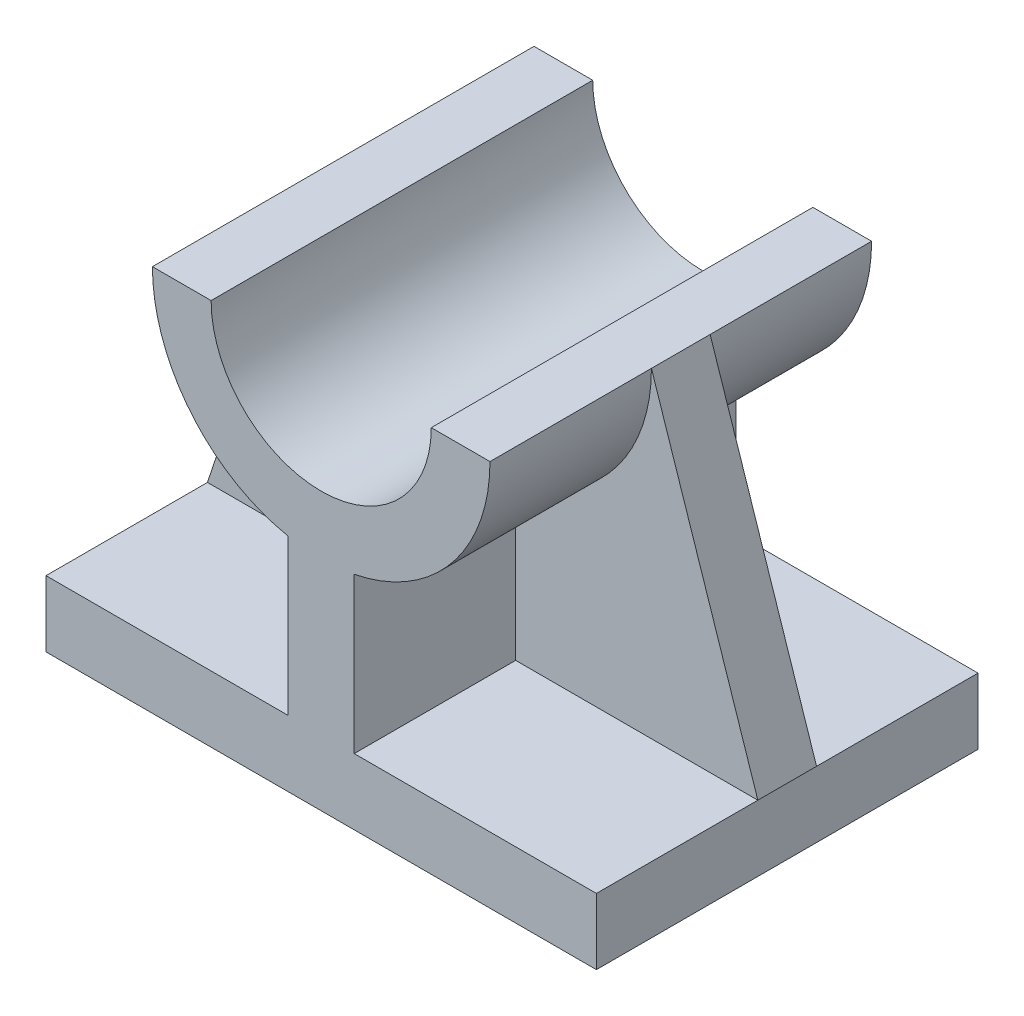
from build123d import *

# Parameters (mm, degrees)
BOSS_EXTRUDE2_DEPTH = 26
RIB1_REACH          = 60.322
SKETCH5_WALL_W      = 164.701059438
SKETCH5_WALL_H      = 8


with BuildPart() as part:
    # Sketch3 → Boss-Extrude2 (new, symmetric)
    with BuildSketch(Plane.XY):
        with BuildLine():
            Line((-37.5, -27.321428571), (-4.5, -27.321428571))
            Line((-4.5, -27.321428571), (-4.5, -6.162629994))
            ThreePointArc((-4.5, -6.162629994), (-17.783419244, 1.806904997), (-23, 16.392857143))
            Line((-23, 16.392857143), (-15, 16.392857143))
            ThreePointArc((-15, 16.392857143), (0, 1.392857143), (15, 16.392857143))
            Line((15, 16.392857143), (23, 16.392857143))
            ThreePointArc((23, 16.392857143), (17.783419244, 1.806904997), (4.5, -6.162629994))
            Line((4.5, -6.162629994), (4.5, -27.321428571))
            Line((4.5, -27.321428571), (37.5, -27.321428571))
            Line((37.5, -27.321428571), (37.5, -36.321428571))
            Line((37.5, -36.321428571), (-37.5, -36.321428571))
            Line((-37.5, -36.321428571), (-37.5, -27.321428571))
        make_face()
    extrude(amount=BOSS_EXTRUDE2_DEPTH, both=True)

    # Sketch5 wall → Rib1 (add, up to next)
    with BuildSketch(Plane(origin=(30.25, -5.464285714, 0), x_dir=(0.314831618537, -0.949147539622, 0), z_dir=(0.949147539622, 0.314831618537, 0)), mode=Mode.PRIVATE) as rib1_sk1:
        Rectangle(SKETCH5_WALL_W, SKETCH5_WALL_H)
    rib1_tool1 = extrude(rib1_sk1.sketch, amount=-RIB1_REACH, mode=Mode.PRIVATE) - part.part
    rib1 = rib1_tool1.solids().sort_by_distance((30.25, -5.464285714, 0))[0]
    add(rib1)

    # Mirror1: Rib1 across plane
    add(rib1.mirror(Plane(origin=(0, 0, 0), x_dir=(0, 0, 1), z_dir=(1, 0, 0))))


solid = part.part
